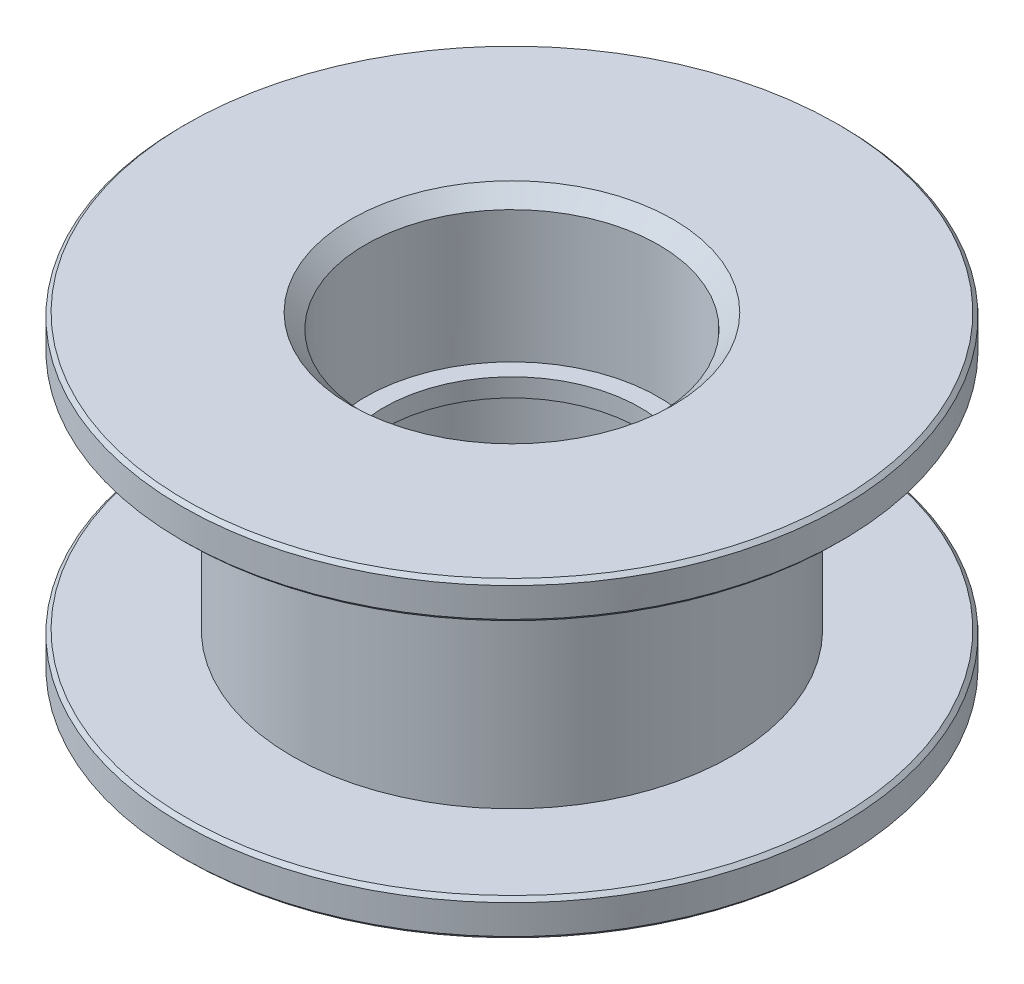
from build123d import *

# Parameters (mm, degrees)
INNERC_SIZE = 0.4
OUTERC_SIZE = 0.1


with BuildPart() as part:
    # BodyS → Body (revolve)
    with BuildSketch(Plane.XY, mode=Mode.PRIVATE) as body_sk:
        Polygon((6, -3.25), (6, 3.25), (9, 3.25), (9, 4.25), (4, 4.25), (4, 0.25), (3.5, 0.25), (3.5, -0.25), (4, -0.25), (4, -4.25), (9, -4.25), (9, -3.25), align=None)
    revolve(body_sk.sketch.rotate(Axis((0, 4.25, 0), (0, -1, 0)), 90), axis=Axis((0, 4.25, 0), (0, -1, 0)))

    # InnerC
    innerc_edges = [part.edges().sort_by_distance(p)[0] for p in [
        (0, -4.25, -4),
        (0, 4.25, -4),
    ]]
    chamfer(innerc_edges, length=INNERC_SIZE)

    # OuterC
    outerc_edges = [part.edges().sort_by_distance(p)[0] for p in [
        (0, 4.25, -9),
        (0, 3.25, -9),
        (0, -3.25, -9),
        (0, -4.25, -9),
    ]]
    chamfer(outerc_edges, length=OUTERC_SIZE)


solid = part.part
